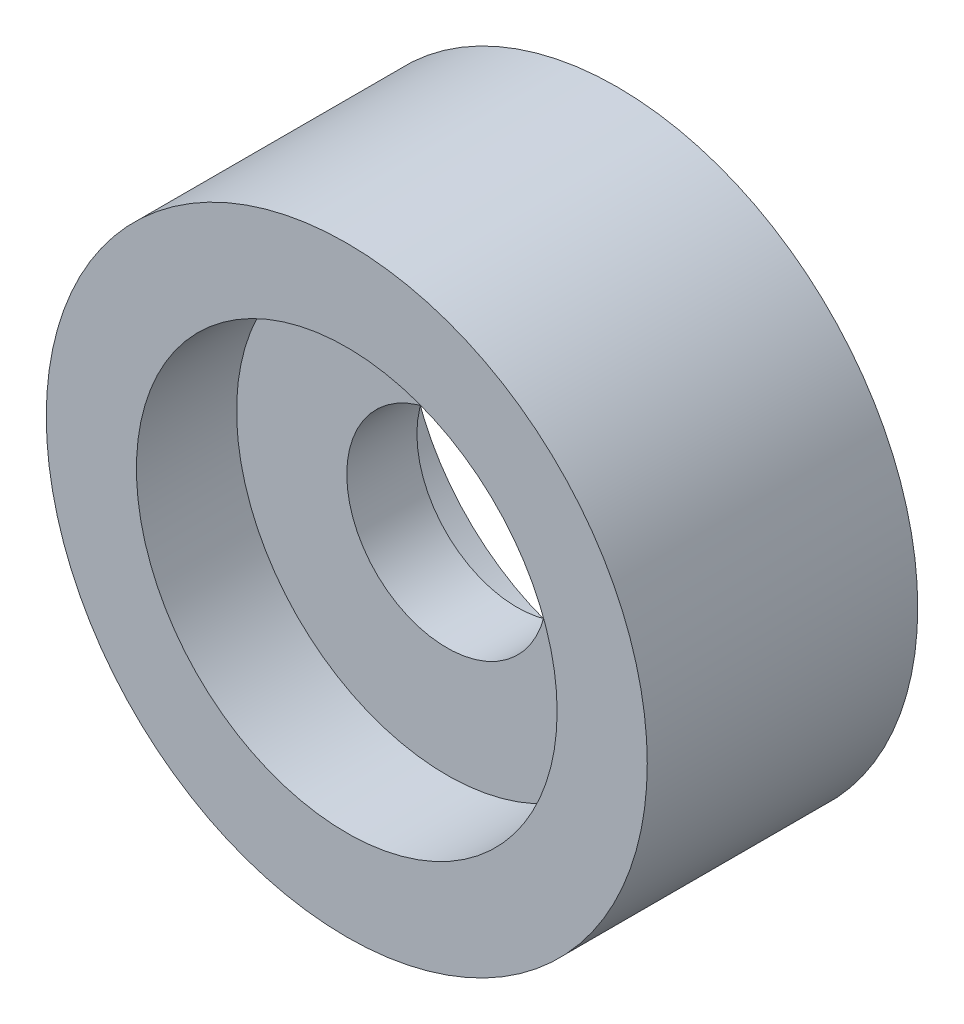
from build123d import *

# Parameters (mm, degrees)
ESQUISSE1_R             = 30
BOSS_EXTRU_1_DEPTH      = 27
ESQUISSE3_R             = 21
ENL_V_MAT_EXTRU_1_DEPTH = 10
ENL_V_START             = -10
ESQUISSE4_R             = 21
ENL_V_MAT_EXTRU_2_DEPTH = 10
ESQUISSE5_R             = 10
ENL_V_MAT_EXTRU_3_DEPTH = 10


with BuildPart() as part:
    # Esquisse1 → Boss.-Extru.1 (new body)
    with BuildSketch(Plane.XY):
        Circle(ESQUISSE1_R)
    extrude(amount=BOSS_EXTRU_1_DEPTH)

    # Esquisse3 → Enlèv. mat.-Extru.1 (cut)
    with BuildSketch(Plane.XY.offset(27)):
        Circle(ESQUISSE3_R)
    extrude(amount=-ENL_V_MAT_EXTRU_1_DEPTH, mode=Mode.SUBTRACT)

    # Esquisse4 → Enlèv. mat.-Extru.2 (cut)
    with BuildSketch(Plane(origin=(0, 0, 0), x_dir=(-1, 0, 0), z_dir=(0, 0, -1)).offset(ENL_V_START)):
        with Locations(Location((0, 0, 0), (0, 0, 180))):
            Circle(ESQUISSE4_R)
    extrude(amount=ENL_V_MAT_EXTRU_2_DEPTH, mode=Mode.SUBTRACT)

    # Esquisse5 → Enlèv. mat.-Extru.3 (cut)
    with BuildSketch(Plane(origin=(0, 0, 10), x_dir=(-1, 0, 0), z_dir=(0, 0, -1))):
        Circle(ESQUISSE5_R)
    extrude(amount=-ENL_V_MAT_EXTRU_3_DEPTH, mode=Mode.SUBTRACT)


solid = part.part
